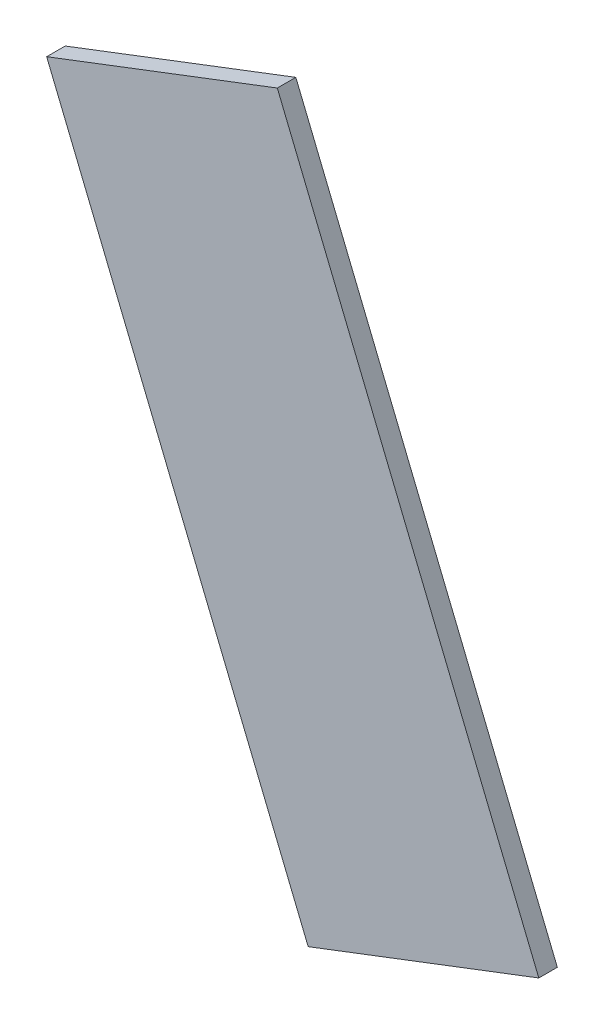
from build123d import *

# Parameters (mm, degrees)
BOSS_EXTRUDE1_DEPTH = 3


with BuildPart() as part:
    # Sketch1 → Boss-Extrude1 (new body)
    with BuildSketch(Plane.XY):
        Polygon((-21.756642947, 68.926707875), (20.606902665, -34.752267829), (-16.755170729, -49.03776648), (-59.118716341, 54.641209225), align=None)
    extrude(amount=BOSS_EXTRUDE1_DEPTH)


solid = part.part
